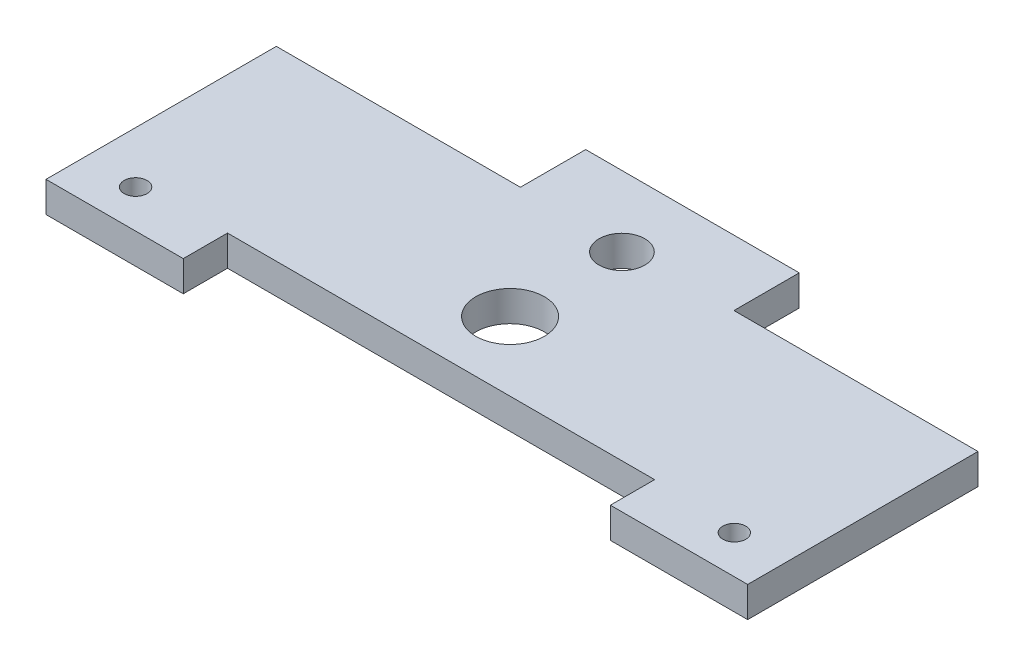
from build123d import *

# Parameters (mm, degrees)
SKETCH1_R           = 0.75
SKETCH1_R_2         = 2.25
SKETCH1_R_3         = 1.5
BOSS_EXTRUDE1_DEPTH = 2


with BuildPart() as part:
    # Sketch1 → Boss-Extrude1 (new body)
    with BuildSketch(Plane(origin=(0, 0, 0), x_dir=(1, 0, 0), z_dir=(0, 1, 0))):
        Polygon((-14, 44.164292058), (-14, 47.064292058), (14, 47.064292058), (14, 44.164292058), (23, 44.164292058), (23, 59.264958065), (7, 59.264958065), (7, 63.545698501), (-7, 63.545698501), (-7, 59.264958065), (-23, 59.264958065), (-23, 44.164292058), align=None)
        with Locations((-19.625, 46.664292058)):
            Circle(SKETCH1_R, mode=Mode.SUBTRACT)
        with Locations((19.625, 46.664292058)):
            Circle(SKETCH1_R, mode=Mode.SUBTRACT)
        with Locations((0, 51.589292058)):
            Circle(SKETCH1_R_2, mode=Mode.SUBTRACT)
        with Locations((0, 58.922150469)):
            Circle(SKETCH1_R_3, mode=Mode.SUBTRACT)
    extrude(amount=BOSS_EXTRUDE1_DEPTH)


solid = part.part
